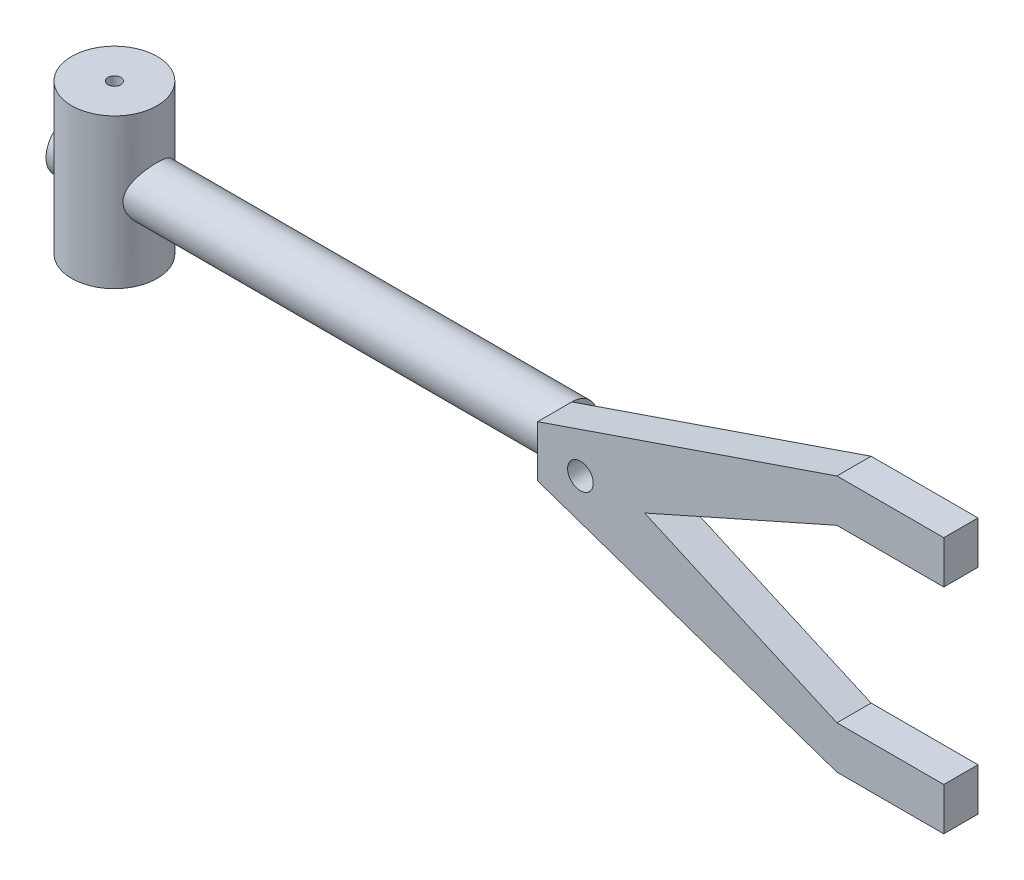
from build123d import *

# Parameters (mm, degrees)
ESQUISSE1_R             = 3
BASE_EXTRUSION_DEPTH    = 8
ESQUISSE2_R             = 6
BOSS_EXTRU_1_DEPTH      = 117
ESQUISSE3_R             = 10
BOSS_EXTRU_2_DEPTH      = 17.5
ESQUISSE4_R             = 1.5
ENL_V_MAT_EXTRU_1_DEPTH = 35


with BuildPart() as part:
    # Esquisse1 → Base-Extrusion (new body)
    with BuildSketch(Plane.XY):
        Polygon((0, 6), (0, -6), (70, -30), (95, -30), (95, -20), (70, -20), (25, 0), (70, 20), (95, 20), (95, 30), (70, 30), align=None)
        with Locations((10, 0)):
            Circle(ESQUISSE1_R, mode=Mode.SUBTRACT)
    extrude(amount=BASE_EXTRUSION_DEPTH)

    # Esquisse2 → Boss.-Extru.1 (add)
    with BuildSketch(Plane.ZY):
        with Locations(Location((0, 0, 0), (0, 0, 90))):
            Circle(ESQUISSE2_R)
    extrude(amount=BOSS_EXTRU_1_DEPTH)

    # Esquisse3 → Boss.-Extru.2 (add, symmetric)
    with BuildSketch(Plane(origin=(0, 0, 0), x_dir=(1, 0, 0), z_dir=(0, 1, 0))):
        with Locations(Location((-107, 0, 0), (0, 0, 270))):
            Circle(ESQUISSE3_R)
    extrude(amount=BOSS_EXTRU_2_DEPTH, both=True)

    # Esquisse4 → Enlèv. mat.-Extru.1 (cut)
    with BuildSketch(Plane(origin=(0, 17.5, 0), x_dir=(-1, 0, 0), z_dir=(0, 1, 0))):
        with Locations(Location((107, 0, 0), (0, 0, 90))):
            Circle(ESQUISSE4_R)
    extrude(amount=-ENL_V_MAT_EXTRU_1_DEPTH, mode=Mode.SUBTRACT)


solid = part.part
